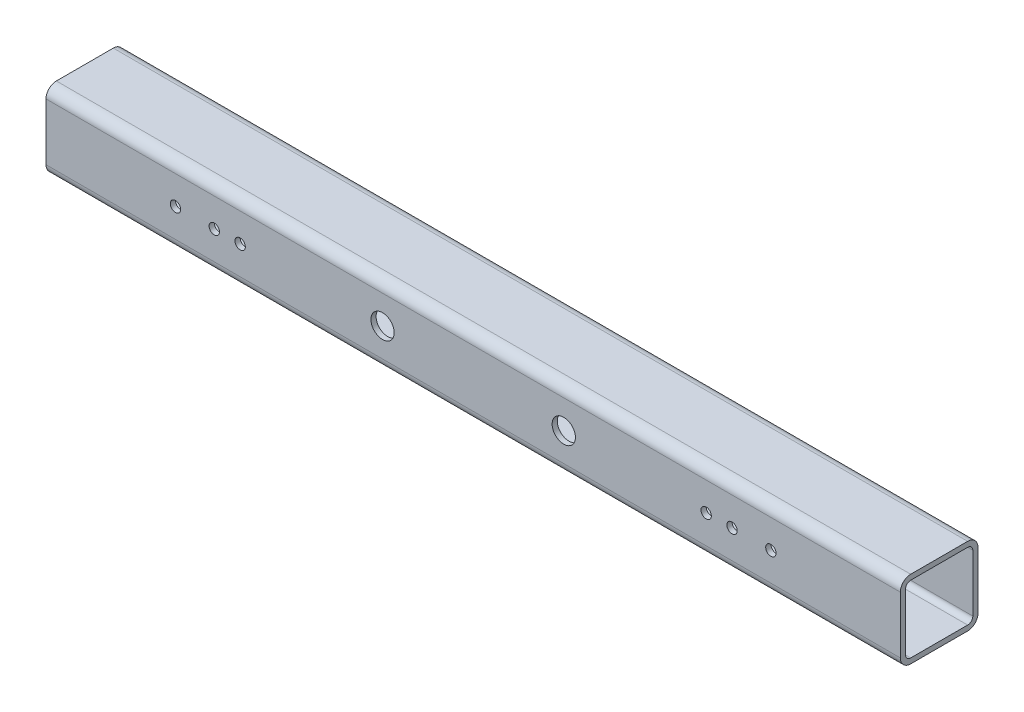
from build123d import *

# Parameters (mm, degrees)
EXTRUDE_1_DEPTH     = 165
SKETCH_2_R          = 4.5
SKETCH_2_R_2        = 2
CUT_EXTRUDE_1_DEPTH = 171.367250374


with BuildPart() as part:
    # 草图1 → 凸台-拉伸1 (new, symmetric)
    with BuildSketch(Plane(origin=(0, 0, 0), x_dir=(0, 0, -1), z_dir=(1, 0, 0))):
        with BuildLine():
            Line((4, 0), (26, 0))
            ThreePointArc((26, 0), (28.828427125, 1.171572875), (30, 4))
            Line((30, 4), (30, 26))
            ThreePointArc((30, 26), (28.828427125, 28.828427125), (26, 30))
            Line((26, 30), (4, 30))
            ThreePointArc((4, 30), (1.171572875, 28.828427125), (0, 26))
            Line((0, 26), (0, 4))
            ThreePointArc((0, 4), (1.171572875, 1.171572875), (4, 0))
        make_face()
        with BuildLine():
            Line((4, 2), (26, 2))
            ThreePointArc((26, 2), (27.414213562, 2.585786438), (28, 4))
            Line((28, 4), (28, 26))
            ThreePointArc((28, 26), (27.414213562, 27.414213562), (26, 28))
            Line((26, 28), (4, 28))
            ThreePointArc((4, 28), (2.585786438, 27.414213562), (2, 26))
            Line((2, 26), (2, 4))
            ThreePointArc((2, 4), (2.585786438, 2.585786438), (4, 2))
        make_face(mode=Mode.SUBTRACT)
    extrude(amount=EXTRUDE_1_DEPTH, both=True)

    # 草图2 → 切除-拉伸1 (cut, through all)
    with BuildSketch(Plane.XY):
        with Locations((-35, 15)):
            Circle(SKETCH_2_R)
        with Locations((35, 15)):
            Circle(SKETCH_2_R)
        with Locations((-115, 15)):
            Circle(SKETCH_2_R_2)
        with Locations((115, 15)):
            Circle(SKETCH_2_R_2)
        with Locations((-100, 15)):
            Circle(SKETCH_2_R_2)
        with Locations((-90, 15)):
            Circle(SKETCH_2_R_2)
        with Locations((90, 15)):
            Circle(SKETCH_2_R_2)
        with Locations((100, 15)):
            Circle(SKETCH_2_R_2)
    extrude(amount=-CUT_EXTRUDE_1_DEPTH, mode=Mode.SUBTRACT)


solid = part.part
